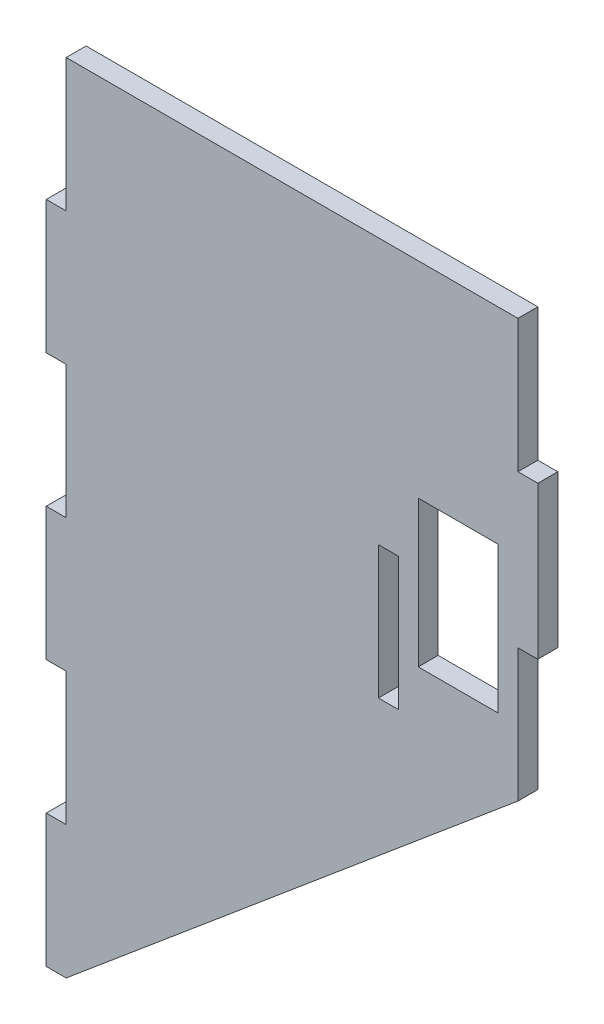
from build123d import *

# Parameters (mm, degrees)
SKETCH1_W           = 3
SKETCH1_H           = 20
SKETCH1_W_2         = 12
SKETCH1_H_2         = 22
BOSS_EXTRUDE1_DEPTH = 3


with BuildPart() as part:
    # Sketch1 → Boss-Extrude1 (new body)
    with BuildSketch(Plane.XY):
        Polygon((-3, 60), (-3, 40), (0, 40), (0, 20), (-3, 20), (-3, 0), (0, 0), (68, 57.05877492), (68, 77.05877492), (71, 77.05877492), (71, 100), (68, 100), (68, 120), (23.5, 120), (0, 120), (0, 100), (-3, 100), (-3, 80), (0, 80), (0, 60), align=None)
        with Locations((48.5, 70)):
            Rectangle(SKETCH1_W, SKETCH1_H, mode=Mode.SUBTRACT)
        with Locations((59, 78.05877492)):
            Rectangle(SKETCH1_W_2, SKETCH1_H_2, mode=Mode.SUBTRACT)
    extrude(amount=BOSS_EXTRUDE1_DEPTH)


solid = part.part
